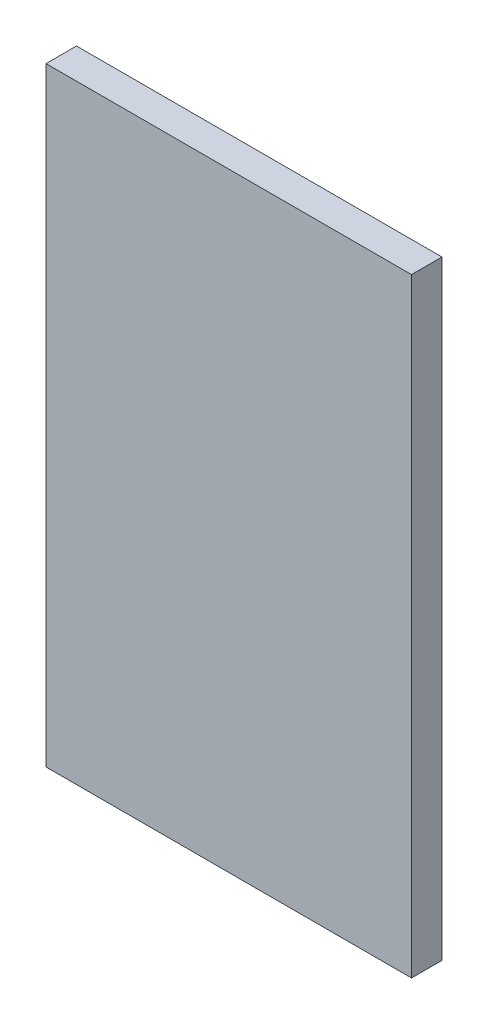
from build123d import *

# Parameters (mm, degrees)
SKETCH1_W           = 120
SKETCH1_H           = 200
BOSS_EXTRUDE1_DEPTH = 10


with BuildPart() as part:
    # Sketch1 → Boss-Extrude1 (new body)
    with BuildSketch(Plane.XY):
        with Locations((-21.102362205, 18.897637795)):
            Rectangle(SKETCH1_W, SKETCH1_H)
    extrude(amount=BOSS_EXTRUDE1_DEPTH)


solid = part.part
